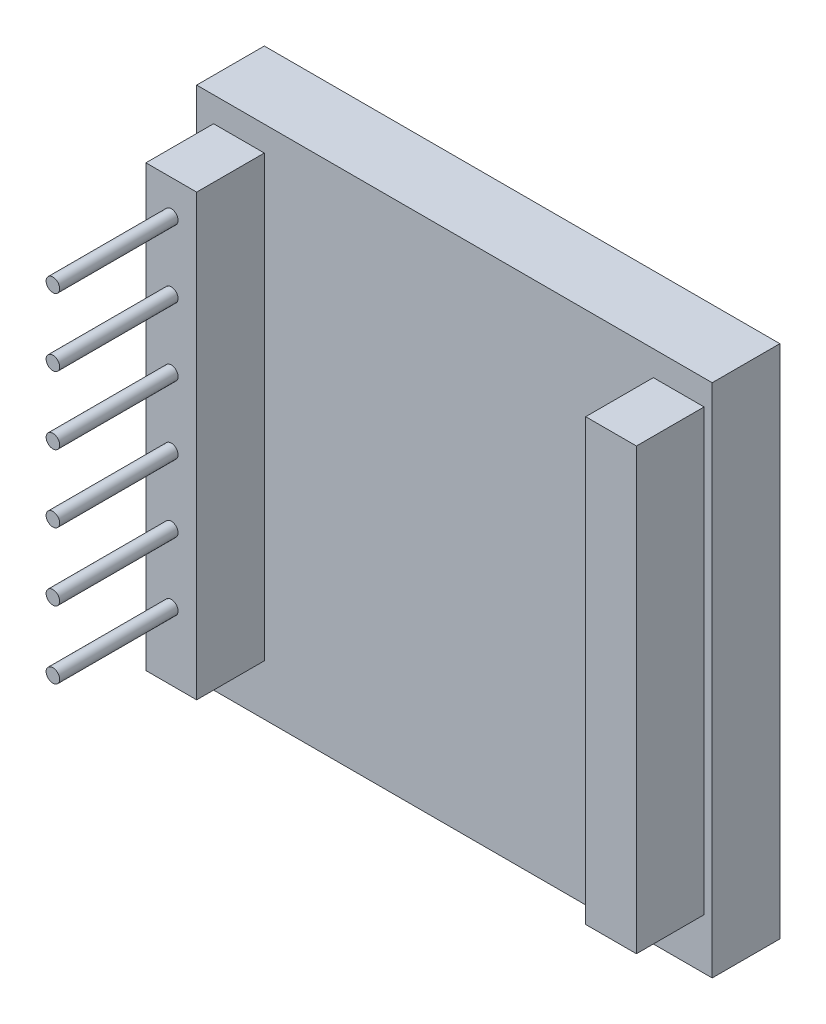
from build123d import *

# Parameters (mm, degrees)
SKETCH_1_W           = 15.24
SKETCH_1_H           = 15.24
EXTRUDE_1_DEPTH      = 2
SKETCH_2_W           = 1.5
SKETCH_2_H           = 13
EXTRUDE_2_DEPTH      = 2
EXTRUDE_3_DEPTH      = 3.5
EXTRUDE_3_DEPTH_BACK = 4.5
SKETCH_3_R           = 0.2


with BuildPart() as part:
    # 草图1 → 凸台-拉伸1 (new body)
    with BuildSketch(Plane.XY):
        with Locations((7.62, 7.62)):
            Rectangle(SKETCH_1_W, SKETCH_1_H)
    extrude(amount=EXTRUDE_1_DEPTH)

    # 草图2 → 凸台-拉伸2 (add)
    with BuildSketch(Plane.XY.offset(2)):
        with Locations((14.25, 8)):
            Rectangle(SKETCH_2_W, SKETCH_2_H)
        with Locations((1.25, 8)):
            Rectangle(SKETCH_2_W, SKETCH_2_H)
    extrude(amount=EXTRUDE_2_DEPTH)

    # 草图3 → 凸台-拉伸3 (add, two sides: drawn at the far end of the back side and taken through both)
    with BuildSketch(Plane.XY.offset(4).offset(-EXTRUDE_3_DEPTH_BACK)):
        with Locations((1.25, 13.5)):
            Circle(SKETCH_3_R)
        with Locations((1.25, 11.5)):
            Circle(SKETCH_3_R)
        with Locations((1.25, 9.5)):
            Circle(SKETCH_3_R)
        with Locations((1.25, 7.5)):
            Circle(SKETCH_3_R)
        with Locations((1.25, 5.5)):
            Circle(SKETCH_3_R)
        with Locations((1.25, 3.5)):
            Circle(SKETCH_3_R)
    extrude(amount=EXTRUDE_3_DEPTH + EXTRUDE_3_DEPTH_BACK)


solid = part.part
